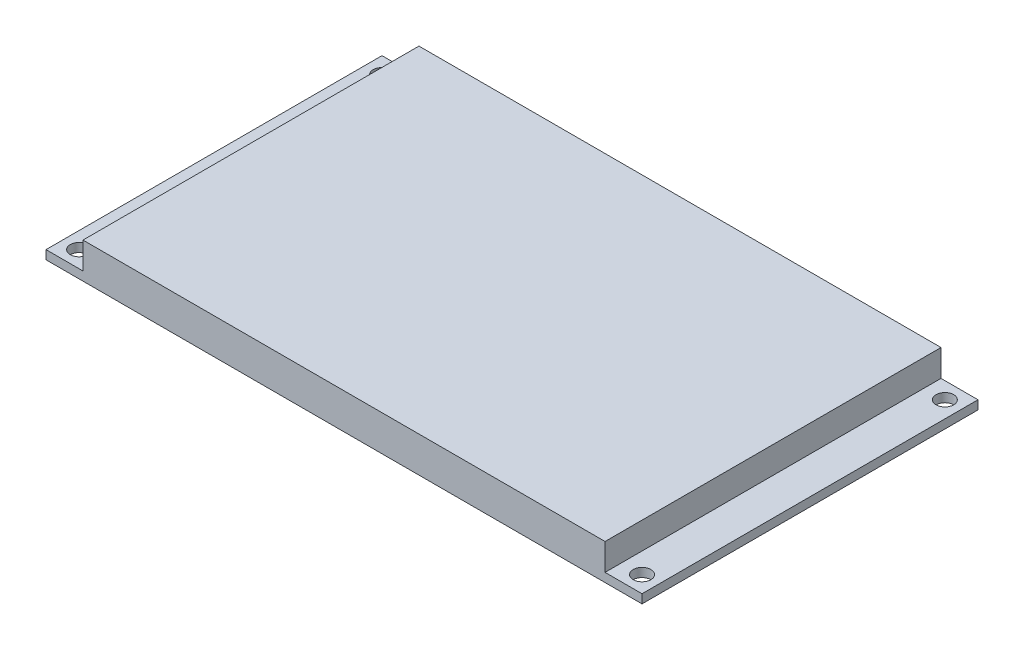
from build123d import *

# Parameters (mm, degrees)
SKETCH_1_W      = 108
SKETCH_1_H      = 60.88
SKETCH_1_R      = 1.6
EXTRUDE_1_DEPTH = 1.6
SKETCH_2_W      = 94.6
SKETCH_2_H      = 60.88
EXTRUDE_2_DEPTH = 4.85
SKETCH_3_W      = 3
SKETCH_3_H      = 35.56
EXTRUDE_3_DEPTH = 8.34


with BuildPart() as part:
    # 草图1 → 凸台-拉伸1 (new body)
    with BuildSketch(Plane(origin=(0, 0, 0), x_dir=(1, 0, 0), z_dir=(0, 1, 0))):
        with Locations((54, 30.44)):
            Rectangle(SKETCH_1_W, SKETCH_1_H)
        with Locations(Location((3, 57.88, 0), (0, 0, 270))):
            Circle(SKETCH_1_R, mode=Mode.SUBTRACT)
        with Locations(Location((3, 3, 0), (0, 0, 270))):
            Circle(SKETCH_1_R, mode=Mode.SUBTRACT)
        with Locations(Location((105, 3, 0), (0, 0, 90))):
            Circle(SKETCH_1_R, mode=Mode.SUBTRACT)
        with Locations(Location((105, 57.88, 0), (0, 0, 90))):
            Circle(SKETCH_1_R, mode=Mode.SUBTRACT)
    extrude(amount=EXTRUDE_1_DEPTH)

    # 草图2 → 凸台-拉伸2 (add)
    with BuildSketch(Plane(origin=(0, 1.6, 0), x_dir=(1, 0, 0), z_dir=(0, 1, 0))):
        with Locations((54, 30.44)):
            Rectangle(SKETCH_2_W, SKETCH_2_H)
    extrude(amount=EXTRUDE_2_DEPTH)

    # 草图3 → 凸台-拉伸3 (add)
    with BuildSketch(Plane.XZ):
        with Locations((1.5, -30.44)):
            Rectangle(SKETCH_3_W, SKETCH_3_H)
    extrude(amount=EXTRUDE_3_DEPTH)


solid = part.part
